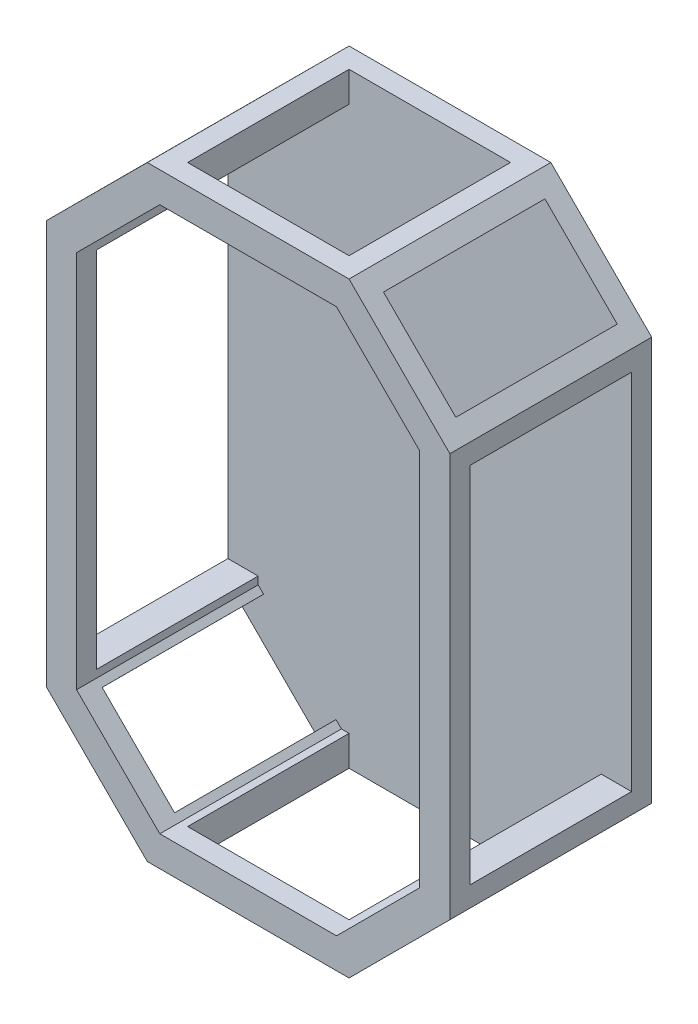
from build123d import *

# Parameters (mm, degrees)
BOSS_EXTRUDE1_DEPTH = 200
CUT_EXTRUDE1_DEPTH  = 180
SKETCH6_W           = 360
SKETCH6_H           = 160
CUT_EXTRUDE2_DEPTH  = 671.794129466
SKETCH7_W           = 101.456658586
SKETCH7_H           = 160
CUT_EXTRUDE3_DEPTH  = 30
SKETCH8_W           = 101.456658586
SKETCH8_H           = 160
CUT_EXTRUDE4_DEPTH  = 30
SKETCH9_W           = 101.37152343
SKETCH9_H           = 160
CUT_EXTRUDE5_DEPTH  = 30
SKETCH10_W          = 101.371523429
SKETCH10_H          = 160
CUT_EXTRUDE6_DEPTH  = 30
SKETCH11_W          = 159.950111148
SKETCH11_H          = 160
CUT_EXTRUDE7_DEPTH  = 749.274973447


with BuildPart() as part:
    # Sketch1 → Boss-Extrude1 (new body)
    with BuildSketch(Plane(origin=(0, 0, 0), x_dir=(0, 1, 0), z_dir=(0, 0, 1))):
        Polygon((-400, 0), (-499.964762884, 99.964762884), (-499.964762884, 299.914874032), (-400, 400), (0, 400), (99.964762884, 299.914874032), (99.964762884, 99.964762884), (0, 0), align=None)
    extrude(amount=BOSS_EXTRUDE1_DEPTH)

    # Sketch4 → Cut-Extrude1 (cut)
    with BuildSketch(Plane.XY.offset(200)):
        Polygon((-30, -387.573593129), (-30, -12.426406871), (-112.391169755, 69.964762884), (-287.499039265, 69.964762884), (-370, -12.43698161), (-370, -387.56301839), (-287.499039265, -469.964762884), (-112.391169755, -469.964762884), align=None)
    extrude(amount=-CUT_EXTRUDE1_DEPTH, mode=Mode.SUBTRACT)

    # Sketch6 → Cut-Extrude2 (cut, through all)
    with BuildSketch(Plane(origin=(-400, 0, 0), x_dir=(0, -1, 0), z_dir=(-1, 0, 0))):
        with Locations((200, 100)):
            Rectangle(SKETCH6_W, SKETCH6_H)
    extrude(amount=-CUT_EXTRUDE2_DEPTH, mode=Mode.SUBTRACT)

    # Sketch7 → Cut-Extrude3 (cut)
    with BuildSketch(Plane(origin=(-199.759333952, 199.9998552, 0), x_dir=(-0.7075320947633997, -0.7066812116362764, 0), z_dir=(-0.7066812116362764, 0.7075320947633997, 0))):
        with Locations((212.284508612, 100)):
            Rectangle(SKETCH7_W, SKETCH7_H)
    extrude(amount=-CUT_EXTRUDE3_DEPTH, mode=Mode.SUBTRACT)

    # Sketch8 → Cut-Extrude4 (cut)
    with BuildSketch(Plane(origin=(-399.759189151, -400.240521248, 0), x_dir=(0.7075320947633943, -0.7066812116362818, 0), z_dir=(-0.7066812116362818, -0.7075320947633943, 0))):
        with Locations((70.387976042, 100)):
            Rectangle(SKETCH8_W, SKETCH8_H)
    extrude(amount=-CUT_EXTRUDE4_DEPTH, mode=Mode.SUBTRACT)

    # Sketch9 → Cut-Extrude5 (cut)
    with BuildSketch(Plane(origin=(0, 0, 0), x_dir=(-0.7071067811865487, 0.7071067811865465, 0), z_dir=(0.7071067811865465, 0.7071067811865487, 0))):
        with Locations((70.685761715, 100)):
            Rectangle(SKETCH9_W, SKETCH9_H)
    extrude(amount=-CUT_EXTRUDE5_DEPTH, mode=Mode.SUBTRACT)

    # Sketch10 → Cut-Extrude6 (cut)
    with BuildSketch(Plane(origin=(200, -200, 0), x_dir=(0.7071067811865439, 0.7071067811865511, 0), z_dir=(0.7071067811865511, -0.7071067811865439, 0))):
        with Locations((-353.52847419, 100)):
            Rectangle(SKETCH10_W, SKETCH10_H)
    extrude(amount=-CUT_EXTRUDE6_DEPTH, mode=Mode.SUBTRACT)

    # Sketch11 → Cut-Extrude7 (cut, through all)
    with BuildSketch(Plane.XZ.offset(499.964762884)):
        with Locations((-199.939818458, 100)):
            Rectangle(SKETCH11_W, SKETCH11_H)
    extrude(amount=-CUT_EXTRUDE7_DEPTH, mode=Mode.SUBTRACT)


solid = part.part
